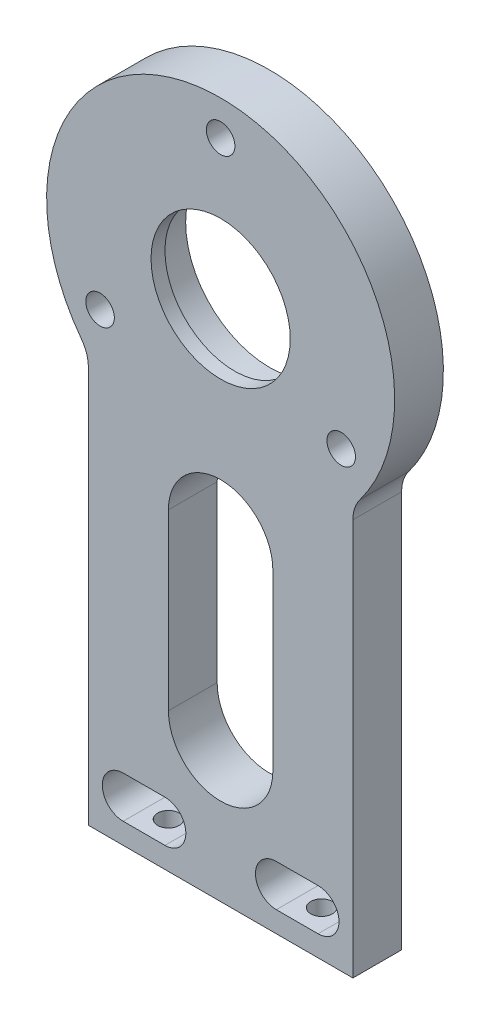
from build123d import *

# Parameters (mm, degrees)
SKETCH_1_R         = 2.05
SKETCH_1_R_2       = 10
EXTRUDE_1_DEPTH    = 3.5
SKETCH1_R          = 12.025
CUT_EXTRUDE2_DEPTH = 5
SKETCH3_R          = 3.6
CUT_EXTRUDE4_DEPTH = 4
SKETCH4_R          = 1.55
CUT_EXTRUDE5_DEPTH = 5


with BuildPart() as part:
    # 草图1 → 凸台-拉伸1 (new, symmetric)
    with BuildSketch(Plane.XY):
        with BuildLine():
            Line((-19, 0), (19, 0))
            Line((19, 0), (19, 57))
            ThreePointArc((19, 57), (19.25658351, 58.58113883), (20, 60))
            ThreePointArc((20, 60), (0, 100), (-20, 60))
            ThreePointArc((-20, 60), (-19.25658351, 58.58113883), (-19, 57))
            Line((-19, 57), (-19, 0))
        make_face()
        with BuildLine():
            Line((7.5, 45), (7.5, 20))
            ThreePointArc((7.5, 20), (0, 12.5), (-7.5, 20))
            Line((-7.5, 20), (-7.5, 45))
            ThreePointArc((-7.5, 45), (-5.303300859, 50.303300859), (0, 52.5))
            ThreePointArc((0, 52.5), (5.303300859, 50.303300859), (7.5, 45))
        make_face(mode=Mode.SUBTRACT)
        with BuildLine():
            ThreePointArc((-8, 9), (-5, 6), (-8, 3))
            Line((-8, 3), (-14, 3))
            ThreePointArc((-14, 3), (-17, 6), (-14, 9))
            Line((-14, 9), (-8, 9))
        make_face(mode=Mode.SUBTRACT)
        with BuildLine():
            ThreePointArc((8, 3), (5, 6), (8, 9))
            Line((8, 9), (14, 9))
            ThreePointArc((14, 9), (17, 6), (14, 3))
            Line((14, 3), (8, 3))
        make_face(mode=Mode.SUBTRACT)
        with Locations((0, 95)):
            Circle(SKETCH_1_R, mode=Mode.SUBTRACT)
        with Locations((-17.320508076, 65)):
            Circle(SKETCH_1_R, mode=Mode.SUBTRACT)
        with Locations((0, 75)):
            Circle(SKETCH_1_R_2, mode=Mode.SUBTRACT)
        with Locations((17.320508076, 65)):
            Circle(SKETCH_1_R, mode=Mode.SUBTRACT)
    extrude(amount=EXTRUDE_1_DEPTH, both=True)

    # Sketch1 → Cut-Extrude2 (cut)
    with BuildSketch(Plane(origin=(0, 0, -3.5), x_dir=(-1, 0, 0), z_dir=(0, 0, -1))):
        with Locations((0, 75)):
            Circle(SKETCH1_R)
    extrude(amount=-CUT_EXTRUDE2_DEPTH, mode=Mode.SUBTRACT)

    # Sketch3 → Cut-Extrude4 (cut)
    with BuildSketch(Plane(origin=(0, 0, -3.5), x_dir=(-1, 0, 0), z_dir=(0, 0, -1))):
        with Locations((0, 95)):
            Circle(SKETCH3_R)
        with Locations((17.320508076, 65)):
            Circle(SKETCH3_R)
        with Locations((-17.320508076, 65)):
            Circle(SKETCH3_R)
    extrude(amount=-CUT_EXTRUDE4_DEPTH, mode=Mode.SUBTRACT)

    # Sketch4 → Cut-Extrude5 (cut)
    with BuildSketch(Plane(origin=(0, 0, 0), x_dir=(-1, 0, 0), z_dir=(0, -1, 0))):
        with Locations(Location((11, 0, 0), (0, 0, 180))):
            Circle(SKETCH4_R)
        with Locations((-11, 0)):
            Circle(SKETCH4_R)
    extrude(amount=-CUT_EXTRUDE5_DEPTH, mode=Mode.SUBTRACT)


solid = part.part
